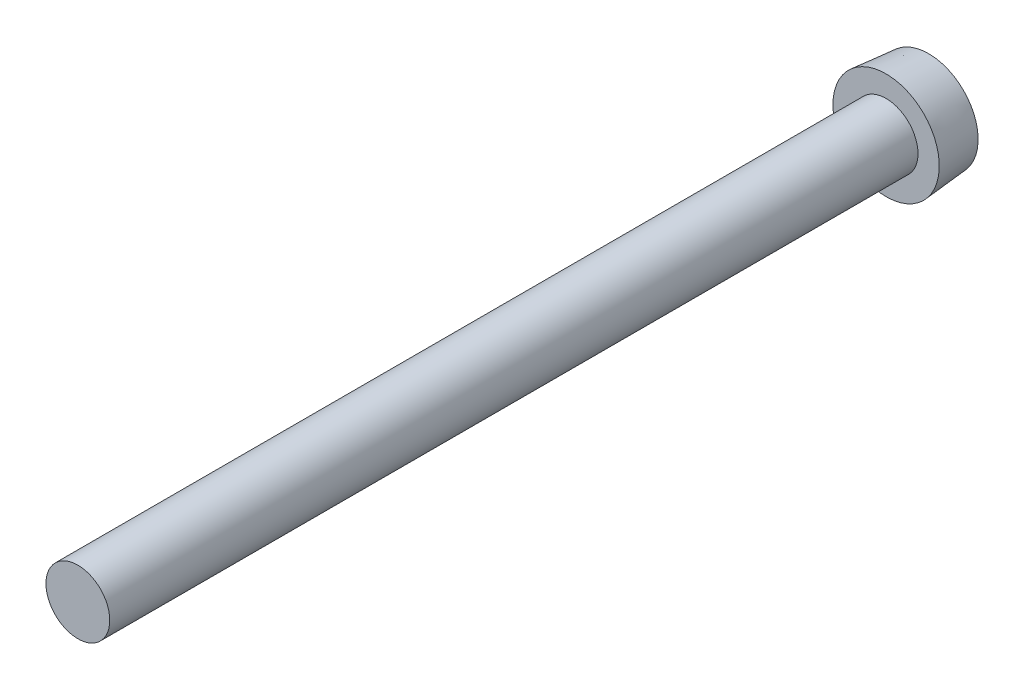
from build123d import *

# Parameters (mm, degrees)
ESQUISSE1_R        = 1.5
BOSS_EXTRU_1_DEPTH = 38
ESQUISSE2_R        = 2.5
BOSS_EXTRU_2_DEPTH = 2
BOSS_EXTRU_2_TAPER = 5


with BuildPart() as part:
    # Esquisse1 → Boss.-Extru.1 (new body)
    with BuildSketch(Plane.XY):
        Circle(ESQUISSE1_R)
    extrude(amount=BOSS_EXTRU_1_DEPTH)

    # Esquisse2 → Boss.-Extru.2 (add)
    with BuildSketch(Plane(origin=(0, 0, 0), x_dir=(-1, 0, 0), z_dir=(0, 0, -1))):
        Circle(ESQUISSE2_R)
    extrude(amount=BOSS_EXTRU_2_DEPTH, taper=BOSS_EXTRU_2_TAPER)


solid = part.part
